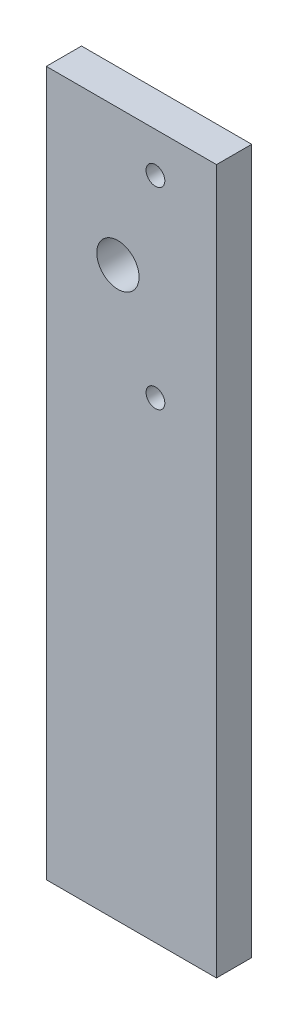
from build123d import *

# Parameters (mm, degrees)
CROQUIS1_W              = 72.48
CROQUIS1_H              = 300
CROQUIS1_R              = 4
CROQUIS1_R_2            = 9
SALIENTE_EXTRUIR1_DEPTH = 15


with BuildPart() as part:
    # Croquis1 → Saliente-Extruir1 (new body)
    with BuildSketch(Plane.XY):
        with Locations((36.24, 150)):
            Rectangle(CROQUIS1_W, CROQUIS1_H)
        with Locations((46.48, 283)):
            Circle(CROQUIS1_R, mode=Mode.SUBTRACT)
        with Locations((46.48, 201)):
            Circle(CROQUIS1_R, mode=Mode.SUBTRACT)
        with Locations((30.5, 242)):
            Circle(CROQUIS1_R_2, mode=Mode.SUBTRACT)
    extrude(amount=SALIENTE_EXTRUIR1_DEPTH)


solid = part.part
